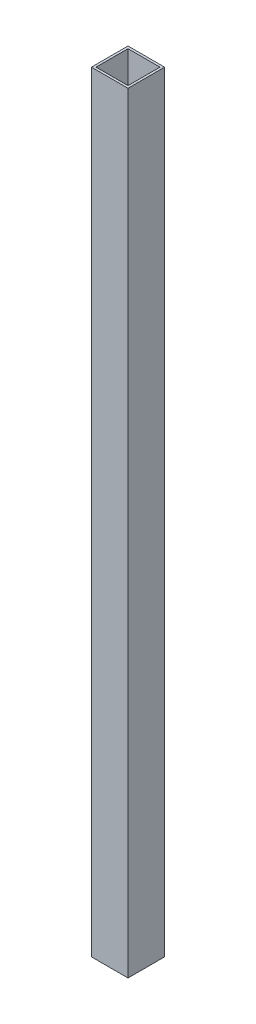
from build123d import *

# Parameters (mm, degrees)
SKETCH1_W           = 19
SKETCH1_H           = 19
SKETCH1_W_2         = 16.6
SKETCH1_H_2         = 16.6
BOSS_EXTRUDE1_DEPTH = 400


with BuildPart() as part:
    # Sketch1 → Boss-Extrude1 (new body)
    with BuildSketch(Plane(origin=(0, 0, 0), x_dir=(1, 0, 0), z_dir=(0, 1, 0))):
        with Locations((9.5, -9.5)):
            Rectangle(SKETCH1_W, SKETCH1_H)
        with Locations((9.5, -9.5)):
            Rectangle(SKETCH1_W_2, SKETCH1_H_2, mode=Mode.SUBTRACT)
    extrude(amount=BOSS_EXTRUDE1_DEPTH)


solid = part.part
